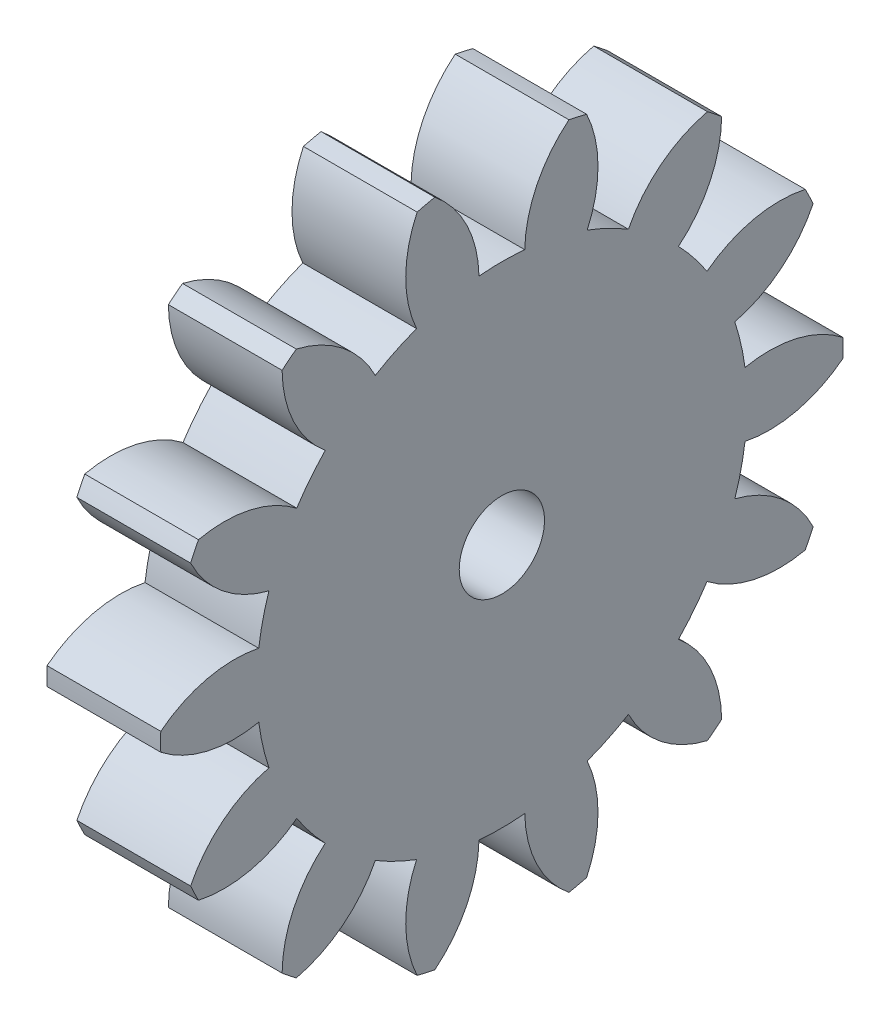
from build123d import *

# Parameters (mm, degrees)
BASPROSKE_W     = 4
BASPROSKE_H     = 12
TOOTHCUT_DEPTH  = 18.435595774
TEETHCUTS_COUNT = 14
TEETHCUTS_ANGLE = 334.285714286
BORSKE_R        = 1.5
BORE_DEPTH      = 50.0000508


with BuildPart() as part:
    # BasProSke → Base-Revolve (revolve)
    with BuildSketch(Plane(origin=(0, 0, 0), x_dir=(1, 0, 0), z_dir=(0, 1, 0)), mode=Mode.PRIVATE) as base_revolve_sk:
        with Locations((2, 6)):
            Rectangle(BASPROSKE_W, BASPROSKE_H)
    revolve(base_revolve_sk.sketch.rotate(Axis((-10, 0, 0), (1, 0, 0)), 180), axis=Axis((-10, 0, 0), (1, 0, 0)))

    # TooCutSke → ToothCut (cut, through all)
    with BuildSketch(Plane(origin=(0, 0, 0), x_dir=(0, 0, -1), z_dir=(1, 0, 0))):
        with BuildLine():
            ThreePointArc((0.804845511, 8.586361261), (0, 8.624), (-0.804845511, 8.586361261))
            ThreePointArc((-0.804845511, 8.586361261), (-1.237812142, 10.362618414), (-2.384428228, 11.78663426))
            ThreePointArc((-2.384428228, 11.78663426), (0, 12.0254), (2.384428228, 11.78663426))
            ThreePointArc((2.384428228, 11.78663426), (1.237812142, 10.362618414), (0.804845511, 8.586361261))
        make_face()
    toothcut = extrude(amount=TOOTHCUT_DEPTH, mode=Mode.SUBTRACT)

    # TeethCuts: ToothCut ×14 about axis
    teethcuts_axis = Axis((-10, 0, 0), (1, 0, 0))
    for i in range(1, TEETHCUTS_COUNT):
        add(toothcut.rotate(teethcuts_axis, i * TEETHCUTS_ANGLE / (TEETHCUTS_COUNT - 1)), mode=Mode.SUBTRACT)

    # BorSke → Bore (cut, symmetric)
    with BuildSketch(Plane(origin=(0, 0, 0), x_dir=(0, 0, -1), z_dir=(1, 0, 0))):
        with Locations(Location((0, 0, 0), (0, 0, 180))):
            Circle(BORSKE_R)
    extrude(amount=BORE_DEPTH, both=True, mode=Mode.SUBTRACT)


solid = part.part
